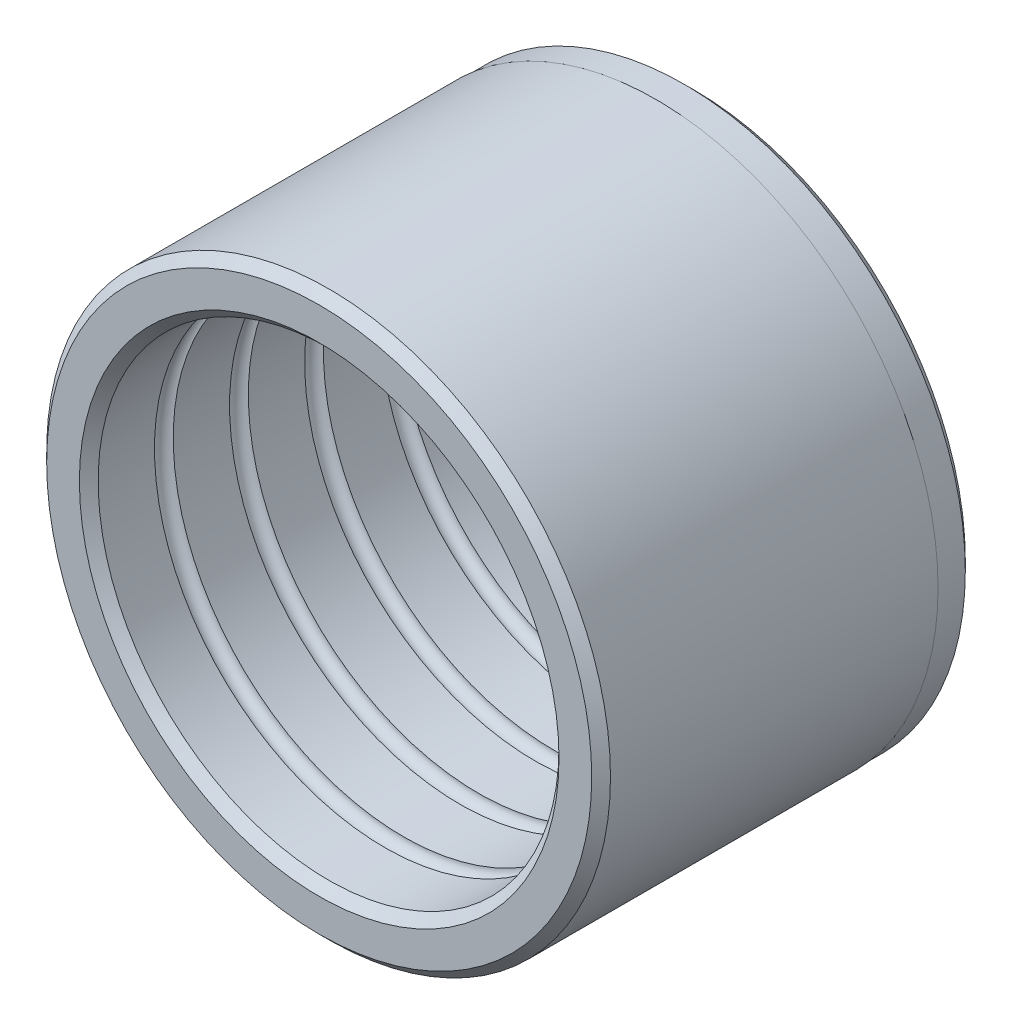
from build123d import *


with BuildPart() as part:
    # Sketch1 → Revolve1 (revolve)
    with BuildSketch(Plane(origin=(0, 0, 0), x_dir=(0, 0, -1), z_dir=(1, 0, 0)), mode=Mode.PRIVATE) as revolve1_sk:
        with BuildLine():
            Line((0.5, 15.0175), (17.95, 15.0175))
            Line((17.95, 15.0175), (17.95, 14.97))
            Line((17.95, 14.97), (19.45, 14.97))
            Line((19.45, 14.97), (19.95, 14.47))
            Line((19.95, 14.47), (19.95, 12.775))
            Line((19.95, 12.775), (19.45, 12.275))
            Line((19.45, 12.275), (16.5, 12.275))
            ThreePointArc((16.5, 12.275), (16, 12.775), (15.5, 12.275))
            Line((15.5, 12.275), (12.5, 12.275))
            ThreePointArc((12.5, 12.275), (12, 12.775), (11.5, 12.275))
            Line((11.5, 12.275), (8.5, 12.275))
            ThreePointArc((8.5, 12.275), (8, 12.775), (7.5, 12.275))
            Line((7.5, 12.275), (4.5, 12.275))
            ThreePointArc((4.5, 12.275), (4, 12.775), (3.5, 12.275))
            Line((3.5, 12.275), (0.5, 12.275))
            Line((0.5, 12.275), (0, 12.775))
            Line((0, 12.775), (0, 14.5175))
            Line((0, 14.5175), (0.5, 15.0175))
        make_face()
    revolve(revolve1_sk.sketch.rotate(Axis((0, 0, 0), (0, 0, -1)), 90), axis=Axis((0, 0, 0), (0, 0, -1)))


solid = part.part
